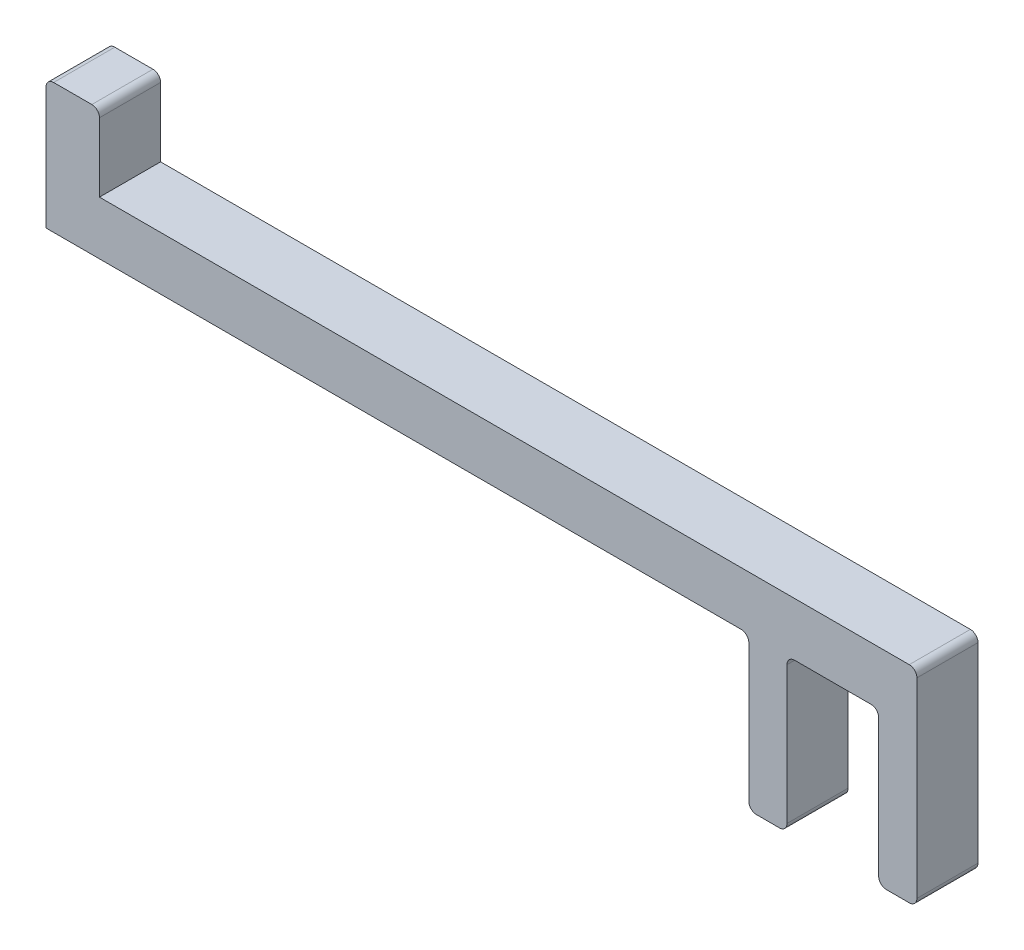
from build123d import *

# Parameters (mm, degrees)
EXTRUDE_1_DEPTH     = 12
CUT_EXTRUDE_1_DEPTH = 82


with BuildPart() as part:
    # Эскиз1 → Бобышка-Вытянуть1 (new body)
    with BuildSketch(Plane.XY):
        with BuildLine():
            Line((-47.73428915, 17), (-42.73428915, 17))
            ThreePointArc((-42.73428915, 17), (-42.027182368, 16.707106781), (-41.73428915, 16))
            Line((-41.73428915, 16), (-41.73428915, 7))
            Line((-41.73428915, 7), (25.229943888, 7))
            Line((25.229943888, 7), (64.26571085, 7))
            ThreePointArc((64.26571085, 7), (64.972817632, 6.707106781), (65.26571085, 6))
            Line((65.26571085, 6), (65.26571085, -19))
            ThreePointArc((65.26571085, -19), (64.972817632, -19.707106781), (64.26571085, -20))
            Line((64.26571085, -20), (61.26571085, -20))
            ThreePointArc((61.26571085, -20), (60.558604069, -19.707106781), (60.26571085, -19))
            Line((60.26571085, -19), (60.26571085, -1))
            ThreePointArc((60.26571085, -1), (59.972817632, -0.292893219), (59.26571085, 0))
            Line((59.26571085, 0), (49.26571085, 0))
            ThreePointArc((49.26571085, 0), (48.558604069, -0.292893219), (48.26571085, -1))
            Line((48.26571085, -1), (48.26571085, -19))
            ThreePointArc((48.26571085, -19), (47.972817632, -19.707106781), (47.26571085, -20))
            Line((47.26571085, -20), (44.26571085, -20))
            ThreePointArc((44.26571085, -20), (43.558604069, -19.707106781), (43.26571085, -19))
            Line((43.26571085, -19), (43.26571085, -1))
            ThreePointArc((43.26571085, -1), (42.972817632, -0.292893219), (42.26571085, 0))
            Line((42.26571085, 0), (-48.73428915, 0))
            Line((-48.73428915, 0), (-48.73428915, 16))
            ThreePointArc((-48.73428915, 16), (-48.441395931, 16.707106781), (-47.73428915, 17))
        make_face()
    extrude(amount=EXTRUDE_1_DEPTH)

    # Эскиз2 → Вырез-Вытянуть1 (cut)
    with BuildSketch(Plane(origin=(0, 17, 0), x_dir=(1, 0, 0), z_dir=(0, 1, 0))):
        Polygon((81.423814873, -4), (-154.472854851, -4), (-146.348766817, 32.606222342), (92.957474686, 29.235711898), align=None)
        Polygon((81.423814873, -16), (-154.472854851, -16), (-172.112104827, -50.666366553), (103.309756763, -54.545547702), align=None)
    extrude(amount=-CUT_EXTRUDE_1_DEPTH, mode=Mode.SUBTRACT)


solid = part.part
